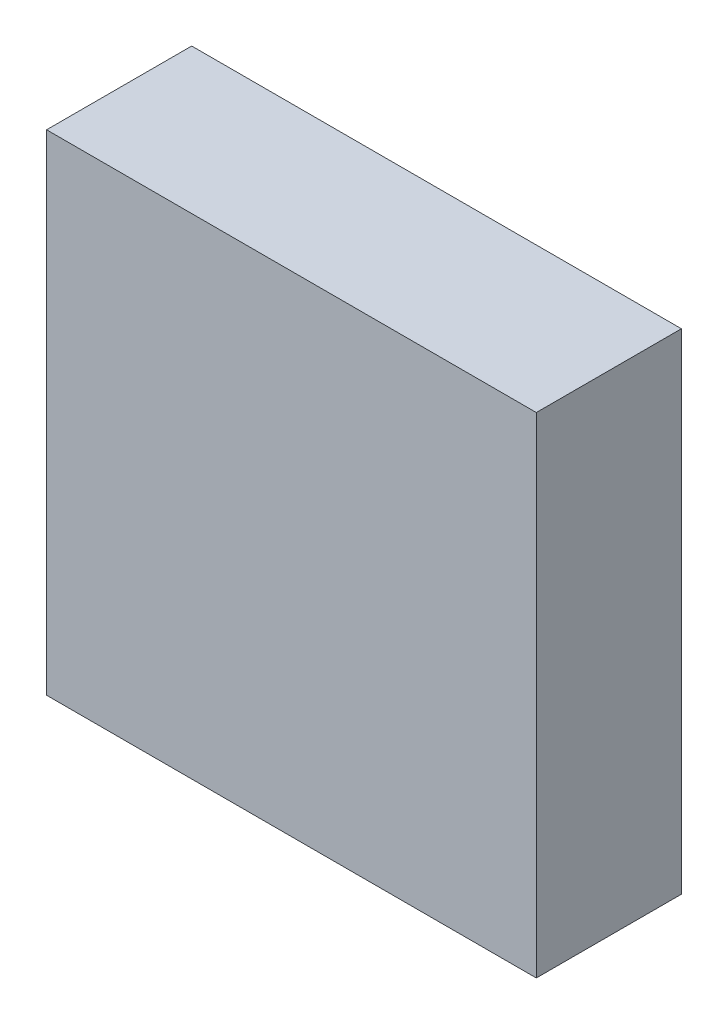
from build123d import *

# Parameters (mm, degrees)
SKETCH1_W           = 171.45
SKETCH1_H           = 171.45
BOSS_EXTRUDE1_DEPTH = 50.8


with BuildPart() as part:
    # Sketch1 → Boss-Extrude1 (new body)
    with BuildSketch(Plane.XY):
        Rectangle(SKETCH1_W, SKETCH1_H)
    extrude(amount=BOSS_EXTRUDE1_DEPTH)


solid = part.part
